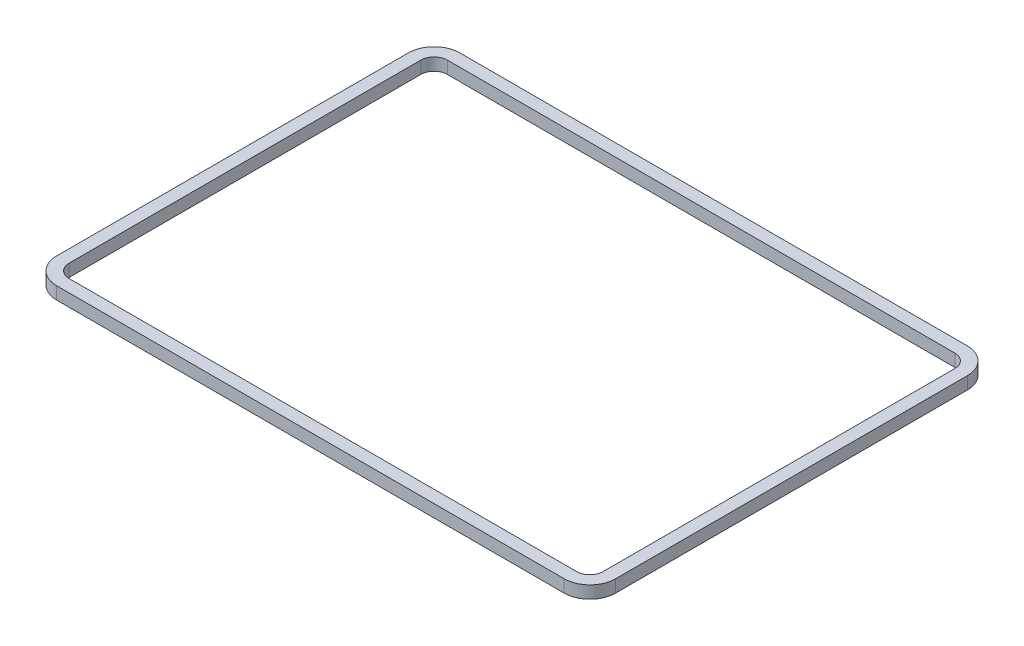
from build123d import *

# Parameters (mm, degrees)
SKETCH1_W      = 227.838
SKETCH1_H      = 164.338
SKETCH1_W_2    = 217.678
SKETCH1_H_2    = 154.178
EXTRUDE1_DEPTH = 5.08
FILLET1_R      = 5.4102
FILLET2_R      = 10.4902


with BuildPart() as part:
    # Sketch1 → Extrude1 (new body)
    with BuildSketch(Plane(origin=(0, 0, 0), x_dir=(1, 0, 0), z_dir=(0, 1, 0))):
        Rectangle(SKETCH1_W, SKETCH1_H)
        Rectangle(SKETCH1_W_2, SKETCH1_H_2, mode=Mode.SUBTRACT)
    extrude(amount=EXTRUDE1_DEPTH)

    # Fillet1
    fillet1_edges = [part.edges().sort_by_distance(p)[0] for p in [
        (-108.839, 2.54, -77.089),
        (-108.839, 2.54, 77.089),
        (108.839, 2.54, 77.089),
        (108.839, 2.54, -77.089),
    ]]
    fillet(fillet1_edges, radius=FILLET1_R)

    # Fillet2
    fillet2_edges = [part.edges().sort_by_distance(p)[0] for p in [
        (-113.919, 2.54, -82.169),
        (113.919, 2.54, -82.169),
        (113.919, 2.54, 82.169),
        (-113.919, 2.54, 82.169),
    ]]
    fillet(fillet2_edges, radius=FILLET2_R)


solid = part.part
